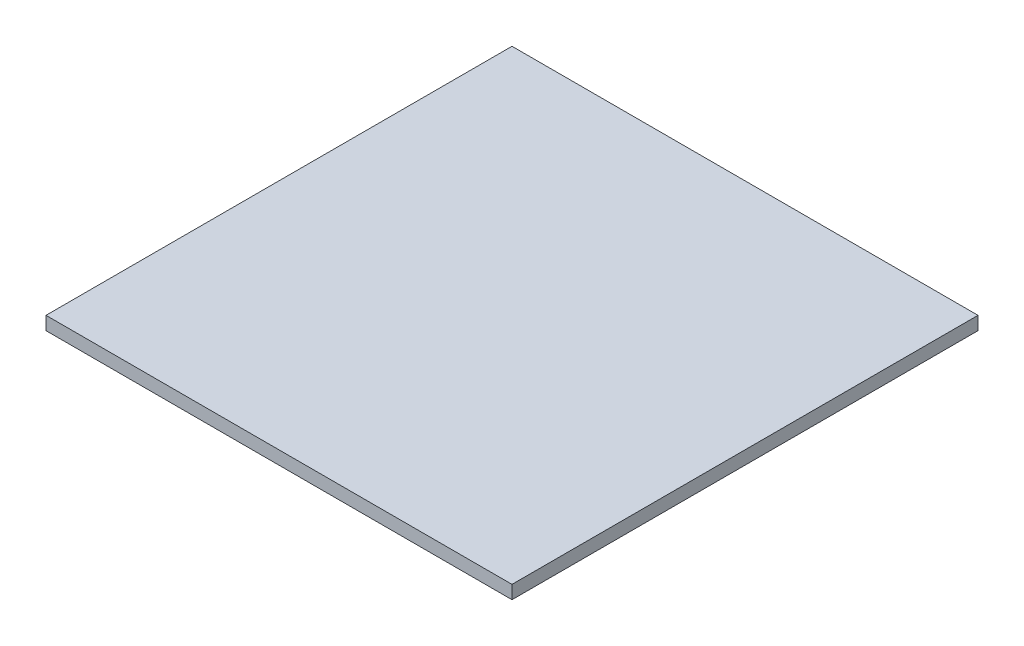
from build123d import *

# Parameters (mm, degrees)
SKETCH1_W           = 105
SKETCH1_H           = 105
BOSS_EXTRUDE1_DEPTH = 3


with BuildPart() as part:
    # Sketch1 → Boss-Extrude1 (new body)
    with BuildSketch(Plane(origin=(0, 0, 0), x_dir=(1, 0, 0), z_dir=(0, 1, 0))):
        Rectangle(SKETCH1_W, SKETCH1_H)
    extrude(amount=BOSS_EXTRUDE1_DEPTH)


solid = part.part
